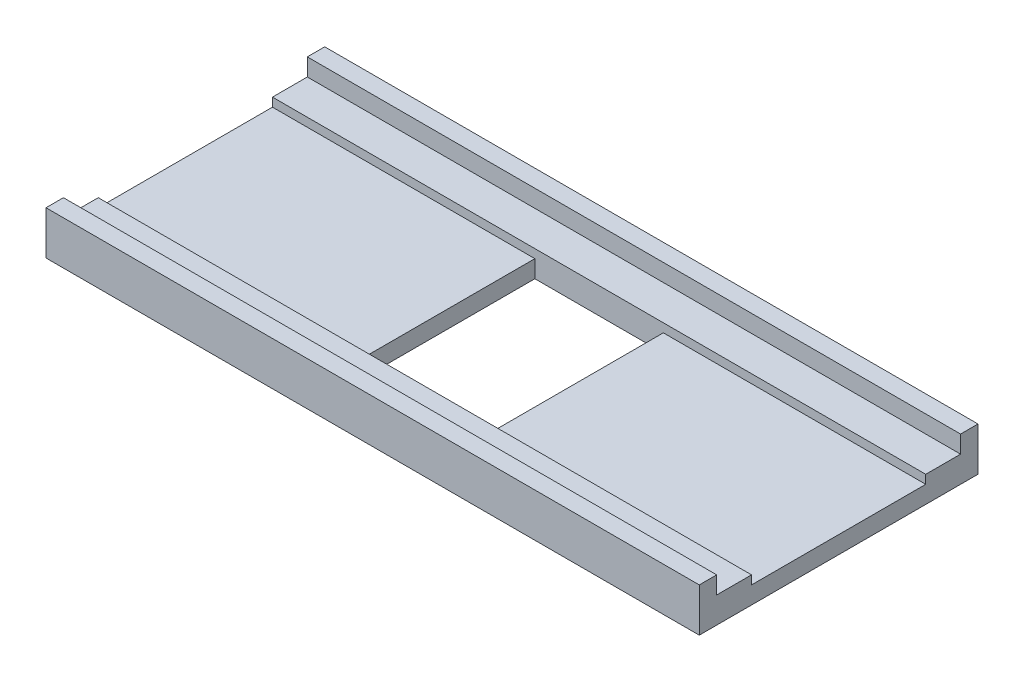
from build123d import *

# Parameters (mm, degrees)
SKETCH1_W           = 75
SKETCH1_H           = 32
BOSS_EXTRUDE1_DEPTH = 3
SKETCH2_W           = 75
SKETCH2_H           = 2
BOSS_EXTRUDE2_DEPTH = 2
SKETCH3_W           = 75
SKETCH3_H           = 2
BOSS_EXTRUDE3_DEPTH = 2
SKETCH6_W           = 14.75
SKETCH6_H           = 20
CUT_EXTRUDE3_DEPTH  = 41.880924647
SKETCH7_W           = 75
SKETCH7_H           = 20
CUT_EXTRUDE4_DEPTH  = 1


with BuildPart() as part:
    # Sketch1 → Boss-Extrude1 (new body)
    with BuildSketch(Plane(origin=(0, 0, 0), x_dir=(1, 0, 0), z_dir=(0, 1, 0))):
        Rectangle(SKETCH1_W, SKETCH1_H)
    extrude(amount=BOSS_EXTRUDE1_DEPTH)

    # Sketch2 → Boss-Extrude2 (add)
    with BuildSketch(Plane(origin=(0, 3, 0), x_dir=(1, 0, 0), z_dir=(0, 1, 0))):
        with Locations((0, 15)):
            Rectangle(SKETCH2_W, SKETCH2_H)
    extrude(amount=BOSS_EXTRUDE2_DEPTH)

    # Sketch3 → Boss-Extrude3 (add)
    with BuildSketch(Plane(origin=(0, 3, 0), x_dir=(1, 0, 0), z_dir=(0, 1, 0))):
        with Locations((0, -15)):
            Rectangle(SKETCH3_W, SKETCH3_H)
    extrude(amount=BOSS_EXTRUDE3_DEPTH)

    # Sketch6 → Cut-Extrude3 (cut, through all)
    with BuildSketch(Plane(origin=(0, 3, 0), x_dir=(1, 0, 0), z_dir=(0, 1, 0))):
        Rectangle(SKETCH6_W, SKETCH6_H)
    extrude(amount=-CUT_EXTRUDE3_DEPTH, mode=Mode.SUBTRACT)

    # Sketch7 → Cut-Extrude4 (cut)
    with BuildSketch(Plane(origin=(0, 3, 0), x_dir=(1, 0, 0), z_dir=(0, 1, 0))):
        Rectangle(SKETCH7_W, SKETCH7_H)
    extrude(amount=-CUT_EXTRUDE4_DEPTH, mode=Mode.SUBTRACT)


solid = part.part
